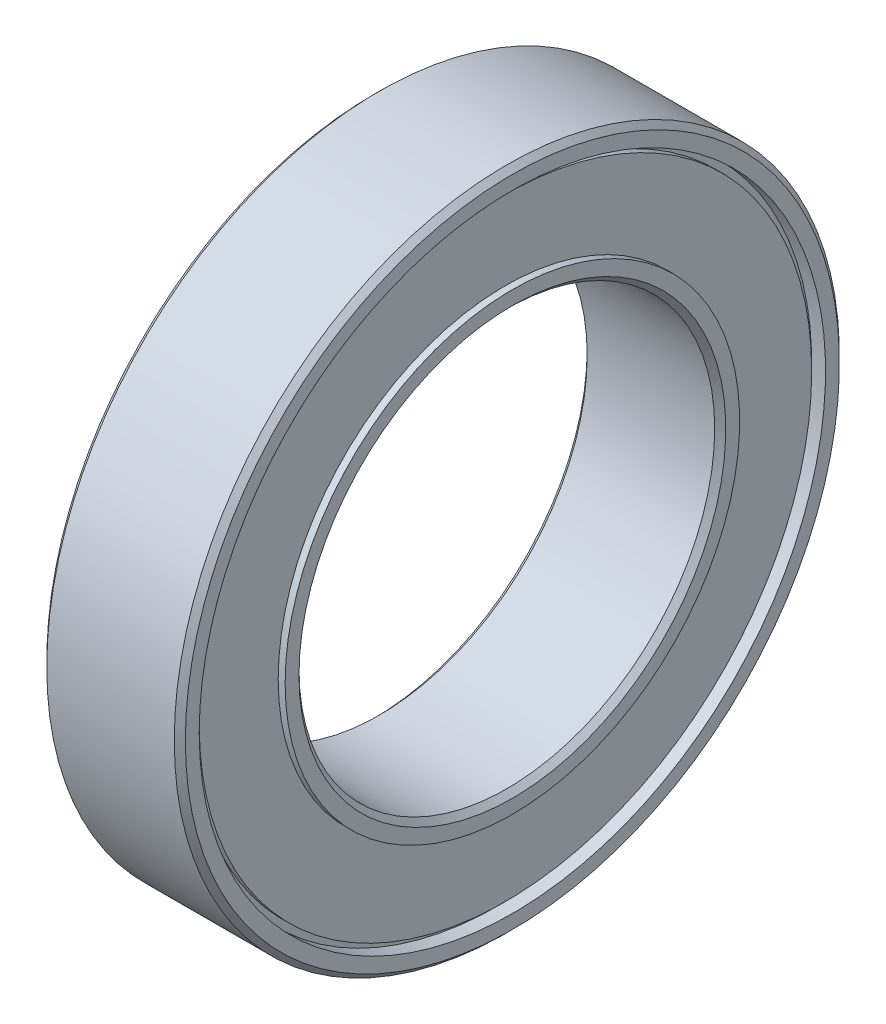
from build123d import *

# Parameters (mm, degrees)
CHAMFER_1_SIZE = 0.2


with BuildPart() as part:
    # 草图1 → 旋转1 (revolve)
    with BuildSketch(Plane.XY, mode=Mode.PRIVATE) as revolve_1_sk:
        Polygon((-2.5, 7.5), (2.5, 7.5), (2.5, 8.2), (2.25, 8.2), (2.25, 11.05), (2, 11.05), (2, 11.3), (2.5, 11.3), (2.5, 12), (-2.5, 12), (-2.5, 11.3), (-2, 11.3), (-2, 11.05), (-2.25, 11.05), (-2.25, 8.2), (-2.5, 8.2), align=None)
    revolve(revolve_1_sk.sketch.rotate(Axis((-3.90102381, 0, 0), (1, 0, 0)), 90), axis=Axis((-3.90102381, 0, 0), (1, 0, 0)))

    # 倒角1
    chamfer_1_edges = [part.edges().sort_by_distance(p)[0] for p in [
        (-2.5, 0, -12),
        (2.5, 0, -12),
        (2.5, 0, -7.5),
        (-2.5, 0, -7.5),
    ]]
    chamfer(chamfer_1_edges, length=CHAMFER_1_SIZE)


solid = part.part
